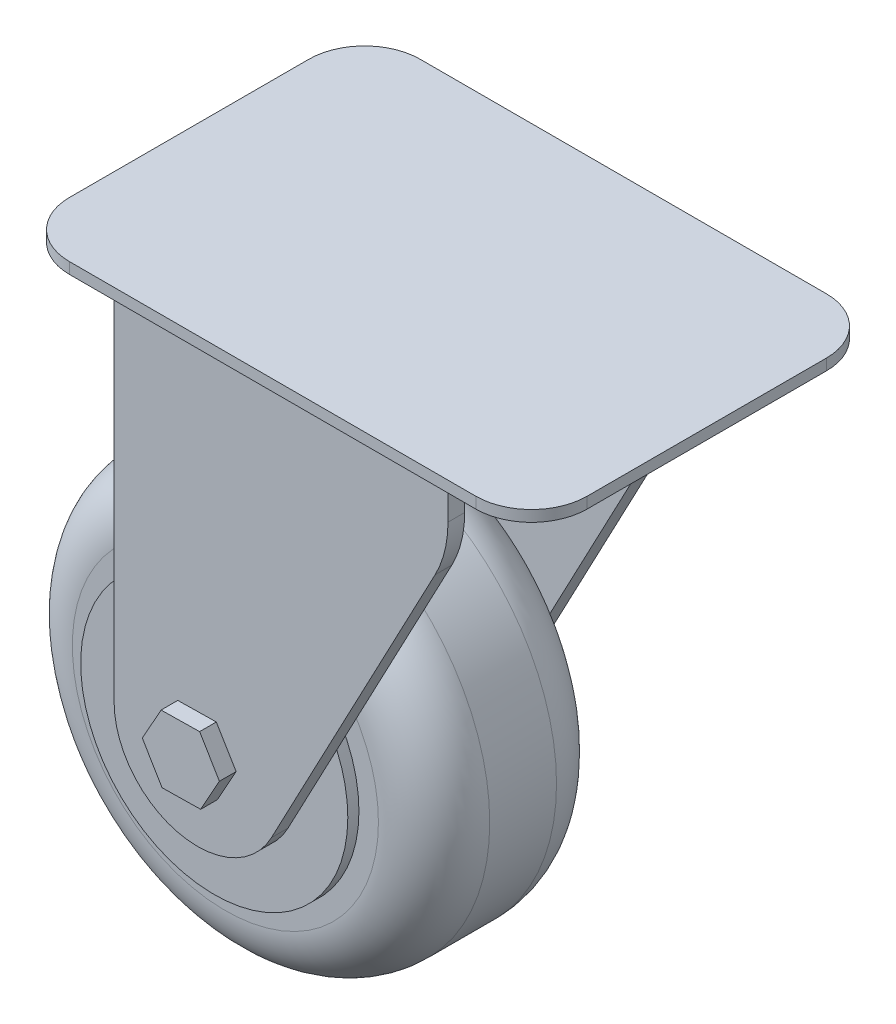
from build123d import *

# Parameters (mm, degrees)
EXTRUDE_1_DEPTH      = 16
EXTRUDE_1_DEPTH_BACK = 16
SKETCH_1_R           = 37.5
SKETCH_1_R_2         = 24
EXTRUDE_2_DEPTH      = 18
EXTRUDE_2_DEPTH_BACK = 18
SKETCH_1_3_R         = 24
EXTRUDE_3_DEPTH      = 24
EXTRUDE_3_DEPTH_BACK = 24
EXTRUDE_4_DEPTH      = 3
EXTRUDE_5_REACH      = 93.722
SKETCH_3_W           = 60
SKETCH_3_H           = 3
SKETCH_4_R           = 21
EXTRUDE_6_DEPTH      = 5
SKETCH_5_R           = 21
EXTRUDE_7_DEPTH      = 2
SKETCH_5_3_W         = 93
SKETCH_5_3_H         = 63
SKETCH_5_3_R         = 21
EXTRUDE_8_DEPTH      = 2
FILLET_1_R           = 10
FILLET_2_R           = 10
FILLET_3_R           = 10


with BuildPart() as part:
    # 스케치1 → 보스-돌출1 (new, two sides: drawn at the far end of the back side and taken through both)
    with BuildSketch(Plane.XY.offset(-EXTRUDE_1_DEPTH_BACK)):
        Circle(SKETCH_1_R)
        Circle(SKETCH_1_R_2, mode=Mode.SUBTRACT)
    extrude(amount=EXTRUDE_1_DEPTH + EXTRUDE_1_DEPTH_BACK)

    # 스케치1<3> → 보스-돌출2 (add, two sides: drawn at the far end of the back side and taken through both)
    with BuildSketch(Plane.XY.offset(-EXTRUDE_2_DEPTH_BACK)):
        Circle(SKETCH_1_3_R)
        Polygon((-3.558612013, 5.944432735), (3.368723753, 6.054064773), (6.927335766, 0.109632038), (3.558612013, -5.944432735), (-3.368723753, -6.054064773), (-6.927335766, -0.109632038), align=None, mode=Mode.SUBTRACT)
    extrude(amount=EXTRUDE_2_DEPTH + EXTRUDE_2_DEPTH_BACK)

    # 스케치1<4> → 보스-돌출3 (add, two sides: drawn at the far end of the back side and taken through both)
    with BuildSketch(Plane.XY.offset(-EXTRUDE_3_DEPTH_BACK)):
        Polygon((6.927335766, 0.109632038), (3.368723753, 6.054064773), (-3.558612013, 5.944432735), (-6.927335766, -0.109632038), (-3.368723753, -6.054064773), (3.558612013, -5.944432735), align=None)
    extrude(amount=EXTRUDE_3_DEPTH + EXTRUDE_3_DEPTH_BACK)

    # 스케치2 → 보스-돌출4 (add)
    with BuildSketch(Plane.XY.offset(18)):
        with BuildLine():
            ThreePointArc((-15, 0), (-3.612820883, -14.558417677), (13.259670035, -7.012927388))
            Line((13.259670035, -7.012927388), (42.679560047, 48.612635579))
            ThreePointArc((42.679560047, 48.612635579), (44.41122357, 53.146110919), (45, 57.96320543))
            Line((45, 57.96320543), (45, 68))
            Line((45, 68), (-15, 68))
            Line((-15, 68), (-15, 0))
        make_face()
        Polygon((3.368723753, 6.054064773), (6.927335766, 0.109632038), (3.558612013, -5.944432735), (-3.368723753, -6.054064773), (-6.927335766, -0.109632038), (-3.558612013, 5.944432735), align=None, mode=Mode.SUBTRACT)
    extrude_4 = extrude(amount=EXTRUDE_4_DEPTH)

    # 대칭 복사1: 보스-돌출4 across plane
    add(extrude_4.mirror(Plane.XY))

    # 스케치3 → 보스-돌출5 (add, up to next)
    with BuildSketch(Plane(origin=(0, 0, 18), x_dir=(-1, 0, 0), z_dir=(0, 0, -1)), mode=Mode.PRIVATE) as extrude_5_sk1:
        with Locations((-15, 66.5)):
            Rectangle(SKETCH_3_W, SKETCH_3_H)
    extrude_5_tool1 = extrude(extrude_5_sk1.sketch, amount=EXTRUDE_5_REACH, mode=Mode.PRIVATE) - part.part
    add(extrude_5_tool1.solids().sort_by_distance((15, 66.5, 18))[0])

    # 스케치4 → 보스-돌출6 (add)
    with BuildSketch(Plane(origin=(0, 68, 0), x_dir=(1, 0, 0), z_dir=(0, 1, 0))):
        with Locations((24, 0)):
            Circle(SKETCH_4_R)
    extrude(amount=EXTRUDE_6_DEPTH)

    # 스케치5 → 보스-돌출7 (add)
    with BuildSketch(Plane(origin=(0, 73, 0), x_dir=(1, 0, 0), z_dir=(0, 1, 0))):
        with Locations((24, 0)):
            Circle(SKETCH_5_R)
    extrude(amount=EXTRUDE_7_DEPTH)

    # 스케치5<3> → 보스-돌출8 (add)
    with BuildSketch(Plane(origin=(0, 73, 0), x_dir=(1, 0, 0), z_dir=(0, 1, 0))):
        with Locations((24, 0)):
            Rectangle(SKETCH_5_3_W, SKETCH_5_3_H)
        with Locations((24, 0)):
            Circle(SKETCH_5_3_R, mode=Mode.SUBTRACT)
    extrude(amount=EXTRUDE_8_DEPTH)

    # 필렛1
    fillet_1_edges = [part.edges().sort_by_distance(p)[0] for p in [
        (-22.5, 74, 31.5),
        (-22.5, 74, -31.5),
        (70.5, 74, -31.5),
        (70.5, 74, 31.5),
    ]]
    fillet(fillet_1_edges, radius=FILLET_1_R)

    # 필렛2
    fillet_2_edges = [part.edges().sort_by_distance(p)[0] for p in [
        (-37.5, 0, 16),
    ]]
    fillet(fillet_2_edges, radius=FILLET_2_R)

    # 필렛3
    fillet_3_edges = [part.edges().sort_by_distance(p)[0] for p in [
        (-37.5, 0, -16),
    ]]
    fillet(fillet_3_edges, radius=FILLET_3_R)


solid = part.part
